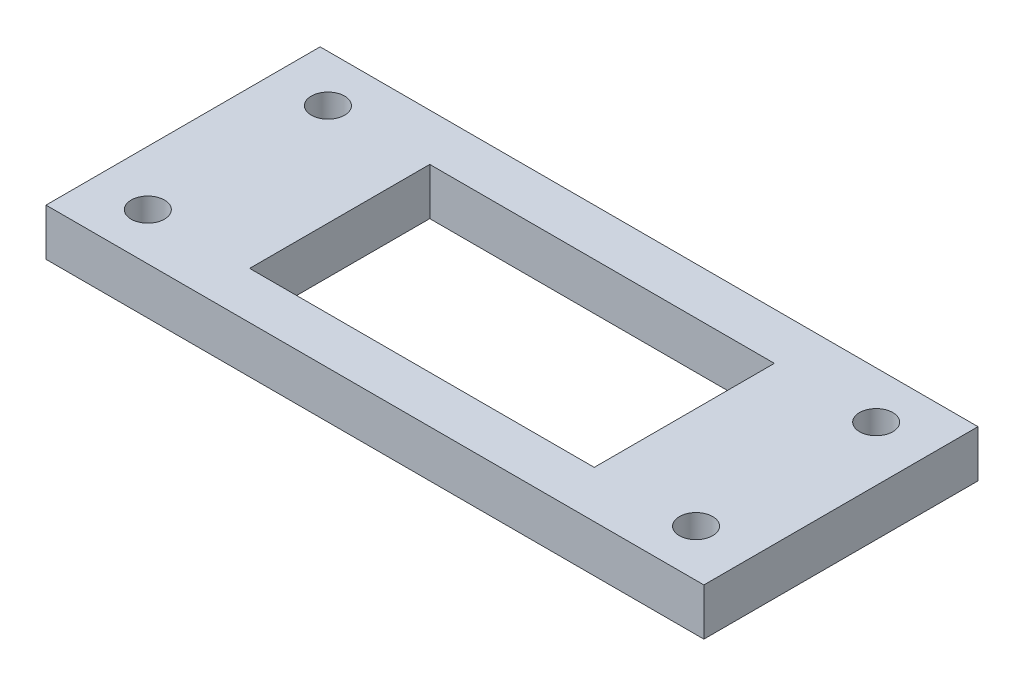
from build123d import *

# Parameters (mm, degrees)
SKETCH1_W                  = 168
SKETCH1_H                  = 70
SKETCH1_R                  = 4.25
SKETCH1_W_2                = 88
SKETCH1_H_2                = 46
BRIDGE_CLAMP_EXTRUDE_DEPTH = 12


with BuildPart() as part:
    # Sketch1 → Bridge_Clamp_Extrude (new body)
    with BuildSketch(Plane(origin=(0, 0, 0), x_dir=(1, 0, 0), z_dir=(0, 1, 0))):
        Rectangle(SKETCH1_W, SKETCH1_H)
        with Locations(Location((-70, -23, 0), (0, 0, 270))):
            Circle(SKETCH1_R, mode=Mode.SUBTRACT)
        with Locations(Location((70, -23, 0), (0, 0, 270))):
            Circle(SKETCH1_R, mode=Mode.SUBTRACT)
        with Locations(Location((-70, 23, 0), (0, 0, 270))):
            Circle(SKETCH1_R, mode=Mode.SUBTRACT)
        with Locations(Location((70, 23, 0), (0, 0, 270))):
            Circle(SKETCH1_R, mode=Mode.SUBTRACT)
        Rectangle(SKETCH1_W_2, SKETCH1_H_2, mode=Mode.SUBTRACT)
    extrude(amount=BRIDGE_CLAMP_EXTRUDE_DEPTH)


solid = part.part
